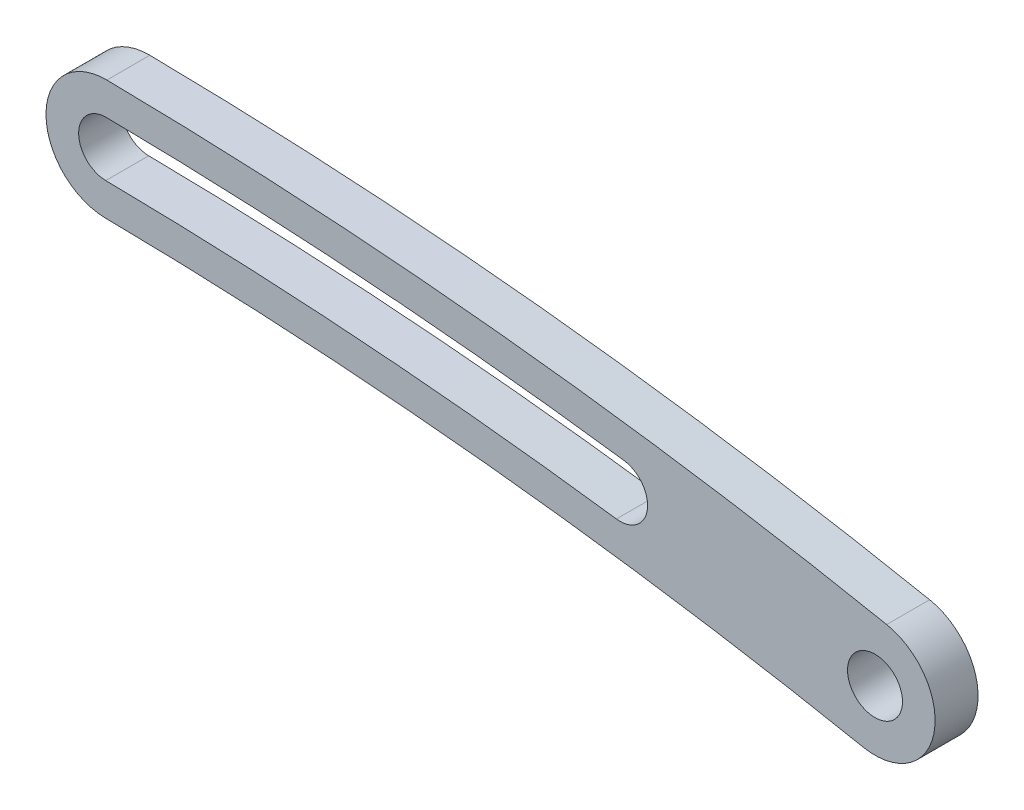
from build123d import *

# Parameters (mm, degrees)
BOSS_EXTRUDE1_DEPTH = 2.5


with BuildPart() as part:
    # Sketch1 → Boss-Extrude1 (new body)
    with BuildSketch(Plane.XY):
        with BuildLine():
            ThreePointArc((-8.510567712, 116.344003682), (-2.565917232, 115.465075188), (3.355702363, 114.442428619))
            ThreePointArc((3.355702363, 114.442428619), (4.893623339, 115.566180636), (6.792287095, 115.718152566))
            ThreePointArc((6.792287095, 115.718152566), (-15.794510782, 119.131957807), (-38.598624107, 120.46983672))
            ThreePointArc((-38.598624107, 120.46983672), (-42.143476749, 117.015271661), (-38.68891169, 113.470419019))
            ThreePointArc((-38.68891169, 113.470419019), (-16.523313538, 112.170000716), (5.431053998, 108.851782021))
            ThreePointArc((5.431053998, 108.851782021), (3.750229497, 109.701636852), (2.753244442, 111.299587114))
            ThreePointArc((2.753244442, 111.299587114), (-3.082169507, 112.306976764), (-8.940234626, 113.172980765))
            ThreePointArc((-8.940234626, 113.172980765), (-23.768861657, 114.724233518), (-38.66440506, 115.370260966))
            ThreePointArc((-38.66440506, 115.370260966), (-40.243634801, 116.990765031), (-38.623130736, 118.569994772))
            ThreePointArc((-38.623130736, 118.569994772), (-23.532953855, 117.915525969), (-8.510567712, 116.344003682))
        make_face()
        with BuildLine():
            ThreePointArc((6.42280954, 113.854423418), (7.348162032, 113.300392724), (7.711670546, 112.284967294))
            ThreePointArc((7.711670546, 112.284967294), (7.127095977, 111.048475808), (5.800531553, 110.715511169))
            ThreePointArc((5.800531553, 110.715511169), (4.277812999, 111.012375136), (2.753244442, 111.299587114))
            ThreePointArc((2.753244442, 111.299587114), (3.750229497, 109.701636852), (5.431053998, 108.851782021))
            ThreePointArc((5.431053998, 108.851782021), (8.332913676, 109.580142168), (9.611670546, 112.284967294))
            ThreePointArc((9.611670546, 112.284967294), (8.816495672, 114.506210423), (6.792287095, 115.718152566))
            ThreePointArc((6.792287095, 115.718152566), (4.893623339, 115.566180636), (3.355702363, 114.442428619))
            ThreePointArc((3.355702363, 114.442428619), (4.890181151, 114.153251974), (6.42280954, 113.854423418))
        make_face()
        with BuildLine():
            ThreePointArc((5.800531553, 110.715511169), (4.542214422, 112.596106287), (6.42280954, 113.854423418))
            ThreePointArc((6.42280954, 113.854423418), (4.890181151, 114.153251974), (3.355702363, 114.442428619))
            ThreePointArc((3.355702363, 114.442428619), (2.674256175, 112.943892509), (2.753244442, 111.299587114))
            ThreePointArc((2.753244442, 111.299587114), (4.277812999, 111.012375136), (5.800531553, 110.715511169))
        make_face()
        with BuildLine():
            ThreePointArc((2.753244442, 111.299587114), (2.674256175, 112.943892509), (3.355702363, 114.442428619))
            ThreePointArc((3.355702363, 114.442428619), (-2.565917232, 115.465075188), (-8.510567712, 116.344003682))
            ThreePointArc((-8.510567712, 116.344003682), (-7.13988971, 114.543658766), (-8.940234626, 113.172980765))
            ThreePointArc((-8.940234626, 113.172980765), (-3.082169507, 112.306976764), (2.753244442, 111.299587114))
        make_face()
    extrude(amount=BOSS_EXTRUDE1_DEPTH)


solid = part.part
